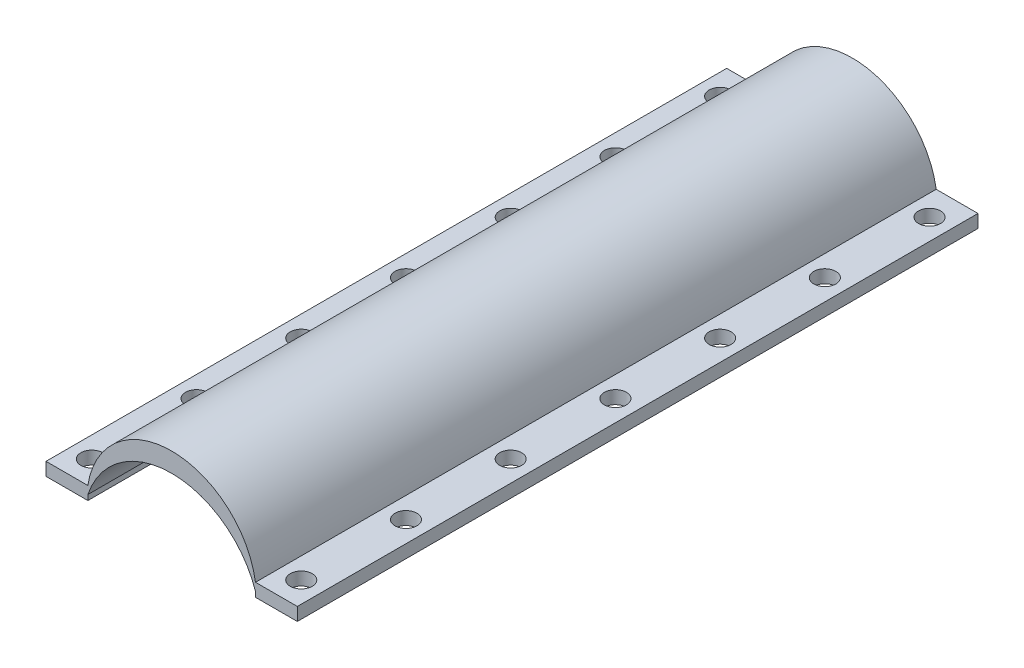
from build123d import *

# Parameters (mm, degrees)
BOSS_EXTRUDE1_DEPTH = 165.1
SKETCH3_R           = 2.667
CUT_EXTRUDE1_DEPTH  = 165.1


with BuildPart() as part:
    # Sketch1 → Boss-Extrude1 (new body)
    with BuildSketch(Plane.XY):
        with BuildLine():
            Line((-5.08, 0), (5.08, 0))
            Line((5.08, 0), (5.08, 1.27))
            ThreePointArc((5.08, 1.27), (25.4, 15.895452724), (45.72, 1.27))
            Line((45.72, 1.27), (45.72, 0))
            Line((45.72, 0), (55.88, 0))
            Line((55.88, 0), (55.88, 3.161651537))
            Line((55.88, 3.161651537), (45.736301675, 3.161651537))
            ThreePointArc((45.736301675, 3.161651537), (25.4, 20.58060267), (5.063698325, 3.161651537))
            Line((5.063698325, 3.161651537), (-5.08, 3.161651537))
            Line((-5.08, 3.161651537), (-5.08, 0))
        make_face()
    extrude(amount=BOSS_EXTRUDE1_DEPTH)

    # Sketch3 → Cut-Extrude1 (cut)
    with BuildSketch(Plane(origin=(0, 3.161651537, 0), x_dir=(1, 0, 0), z_dir=(0, 1, 0))):
        with Locations(Location((0, -6.6675, 0), (0, 0, 270))):
            Circle(SKETCH3_R)
        with Locations(Location((0, -32.0675, 0), (0, 0, 270))):
            Circle(SKETCH3_R)
        with Locations(Location((0, -57.4675, 0), (0, 0, 270))):
            Circle(SKETCH3_R)
        with Locations(Location((0, -82.8675, 0), (0, 0, 270))):
            Circle(SKETCH3_R)
        with Locations(Location((0, -108.2675, 0), (0, 0, 270))):
            Circle(SKETCH3_R)
        with Locations(Location((0, -133.6675, 0), (0, 0, 270))):
            Circle(SKETCH3_R)
        with Locations(Location((0, -159.0675, 0), (0, 0, 270))):
            Circle(SKETCH3_R)
        with Locations(Location((50.8, -159.0675, 0), (0, 0, 180))):
            Circle(SKETCH3_R)
        with Locations(Location((50.8, -133.6675, 0), (0, 0, 180))):
            Circle(SKETCH3_R)
        with Locations(Location((50.8, -108.2675, 0), (0, 0, 180))):
            Circle(SKETCH3_R)
        with Locations(Location((50.8, -82.8675, 0), (0, 0, 180))):
            Circle(SKETCH3_R)
        with Locations(Location((50.8, -57.4675, 0), (0, 0, 180))):
            Circle(SKETCH3_R)
        with Locations(Location((50.8, -32.0675, 0), (0, 0, 180))):
            Circle(SKETCH3_R)
        with Locations(Location((50.8, -6.6675, 0), (0, 0, 180))):
            Circle(SKETCH3_R)
    extrude(amount=-CUT_EXTRUDE1_DEPTH, mode=Mode.SUBTRACT)


solid = part.part
